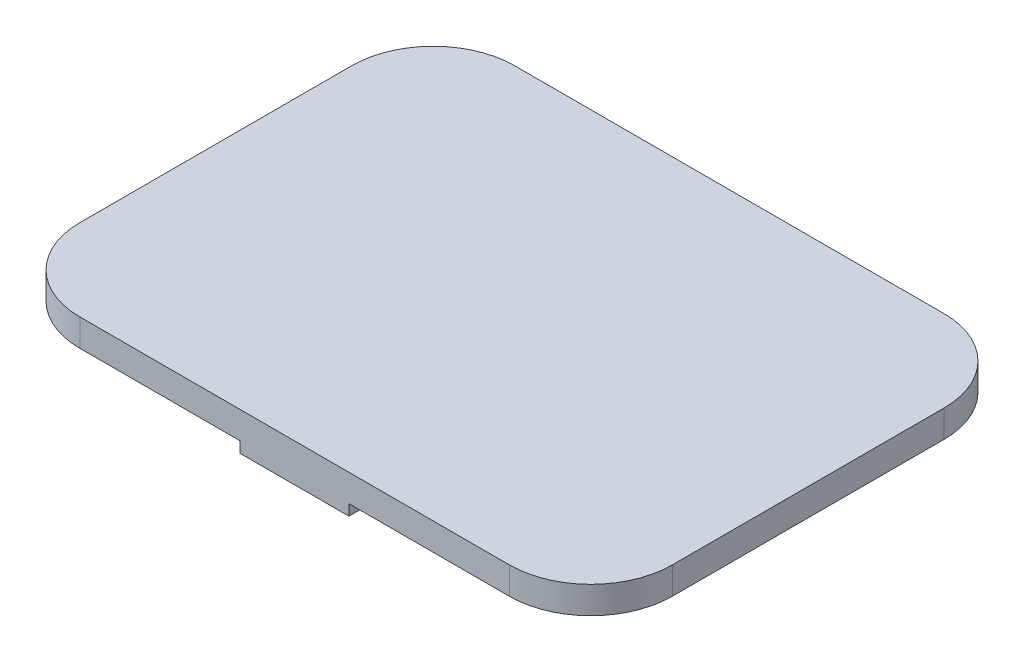
from build123d import *

# Parameters (mm, degrees)
BOSS_EXTRUDE1_DEPTH = 5
BOSS_EXTRUDE2_DEPTH = 10


with BuildPart() as part:
    # Sketch1 → Boss-Extrude1 (new body)
    with BuildSketch(Plane(origin=(0, 0, 0), x_dir=(1, 0, 0), z_dir=(0, 1, 0))):
        with BuildLine():
            Line((-39.5, 40), (39.5, 40))
            ThreePointArc((39.5, 40), (50.106601718, 35.606601718), (54.5, 25))
            Line((54.5, 25), (54.5, -25))
            ThreePointArc((54.5, -25), (50.106601718, -35.606601718), (39.5, -40))
            Line((39.5, -40), (-39.5, -40))
            ThreePointArc((-39.5, -40), (-50.106601718, -35.606601718), (-54.5, -25))
            Line((-54.5, -25), (-54.5, 25))
            ThreePointArc((-54.5, 25), (-50.106601718, 35.606601718), (-39.5, 40))
        make_face()
    extrude(amount=BOSS_EXTRUDE1_DEPTH)

    # Sketch2 → Boss-Extrude2 (add, symmetric)
    with BuildSketch(Plane(origin=(0, 0, 0), x_dir=(0, 0, -1), z_dir=(1, 0, 0))):
        Polygon((-37.5, 0), (-40, 0), (-40, -2), (-37.5, -2), (-36.5, -1), align=None)
    boss_extrude2 = extrude(amount=BOSS_EXTRUDE2_DEPTH, both=True)

    # Mirror1: Boss-Extrude2 across plane
    add(boss_extrude2.mirror(Plane.XY))


solid = part.part
